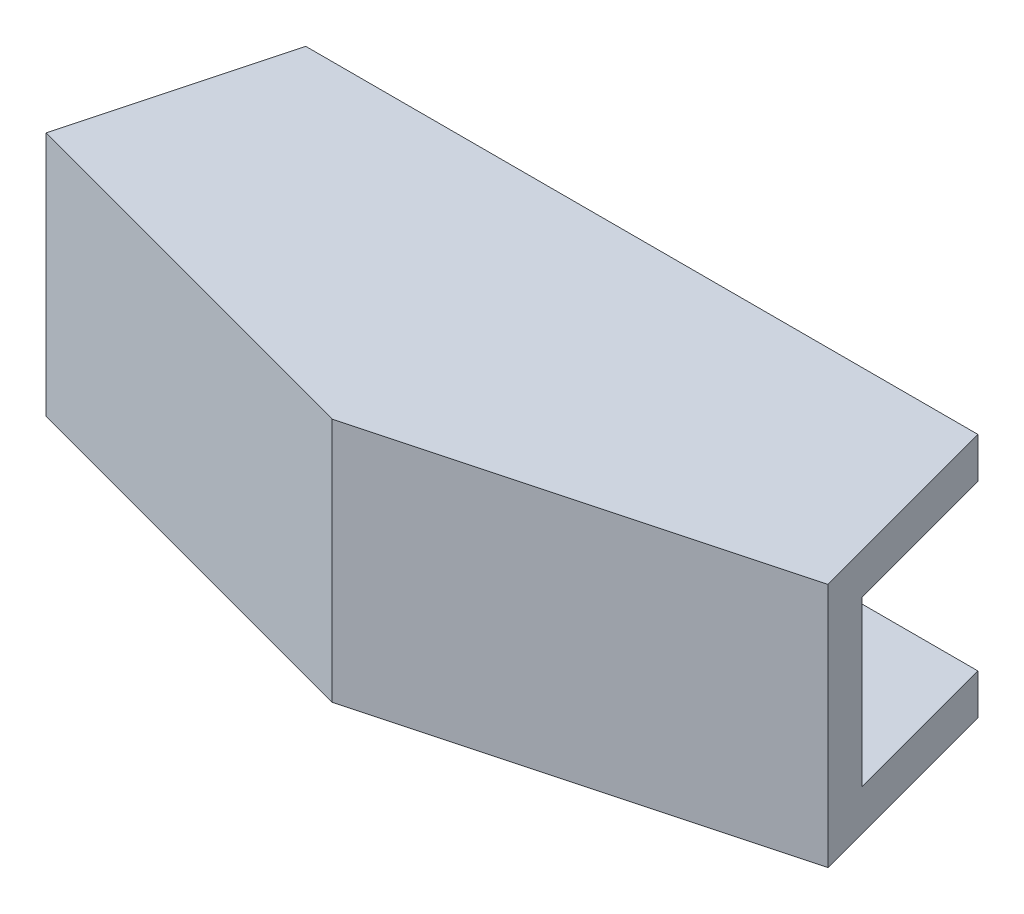
from build123d import *

# Parameters (mm, degrees)
BOSS_EXTRUDE3_DEPTH  = 5
BOSS_EXTRUDE4_DEPTH  = 20.3
BOSS_EXTRUDE5_DEPTH  = 5
BOSS_EXTRUDE16_DEPTH = 5
BOSS_EXTRUDE17_DEPTH = 5


with BuildPart() as part:
    # Sketch4 → Boss-Extrude3 (new body)
    with BuildSketch(Plane(origin=(0, 0, 0), x_dir=(1, 0, 0), z_dir=(0, 1, 0))):
        Polygon((-53.467203663, -64.48008602), (-5.170912349, -51.539133765), (-11.950631556, -26.23687722), (-53.467203663, -37.361209189), (-94.98377577, -26.23687722), (-101.763494978, -51.539133765), align=None)
    extrude(amount=BOSS_EXTRUDE3_DEPTH)

    # Sketch5 → Boss-Extrude4 (add)
    with BuildSketch(Plane(origin=(0, 5, 0), x_dir=(1, 0, 0), z_dir=(0, 1, 0))):
        Polygon((-45.713177048, -56.299630481), (-6.696604941, -45.845171494), (-5.170912349, -51.539133765), (-53.467203663, -64.48008602), (-101.763494978, -51.539133765), (-100.237802385, -45.845171494), (-61.221230279, -56.299630481), (-55.967203663, -36.691336208), (-53.467203663, -37.361209189), (-50.967203663, -36.691336208), align=None)
    extrude(amount=BOSS_EXTRUDE4_DEPTH)

    # Sketch6 → Boss-Extrude5 (add)
    with BuildSketch(Plane(origin=(0, 25.3, 0), x_dir=(1, 0, 0), z_dir=(0, 1, 0))):
        Polygon((-5.170912349, -51.539133765), (-11.950631556, -26.23687722), (-53.467203663, -37.361209189), (-94.98377577, -26.23687722), (-101.763494978, -51.539133765), (-53.467203663, -64.48008602), align=None)
    extrude(amount=BOSS_EXTRUDE5_DEPTH)

    # Sketch20 → Boss-Extrude16 (add)
    with BuildSketch(Plane.XZ.offset(-25.3)):
        Polygon((-94.98377577, 26.23687722), (-11.950631556, 26.23687722), (-53.467203663, 37.361209189), align=None)
    extrude(amount=-BOSS_EXTRUDE16_DEPTH)

    # Sketch21 → Boss-Extrude17 (add)
    with BuildSketch(Plane.XZ):
        Polygon((-11.950631556, 26.23687722), (-53.467203663, 37.361209189), (-94.98377577, 26.23687722), align=None)
    extrude(amount=-BOSS_EXTRUDE17_DEPTH)


solid = part.part
